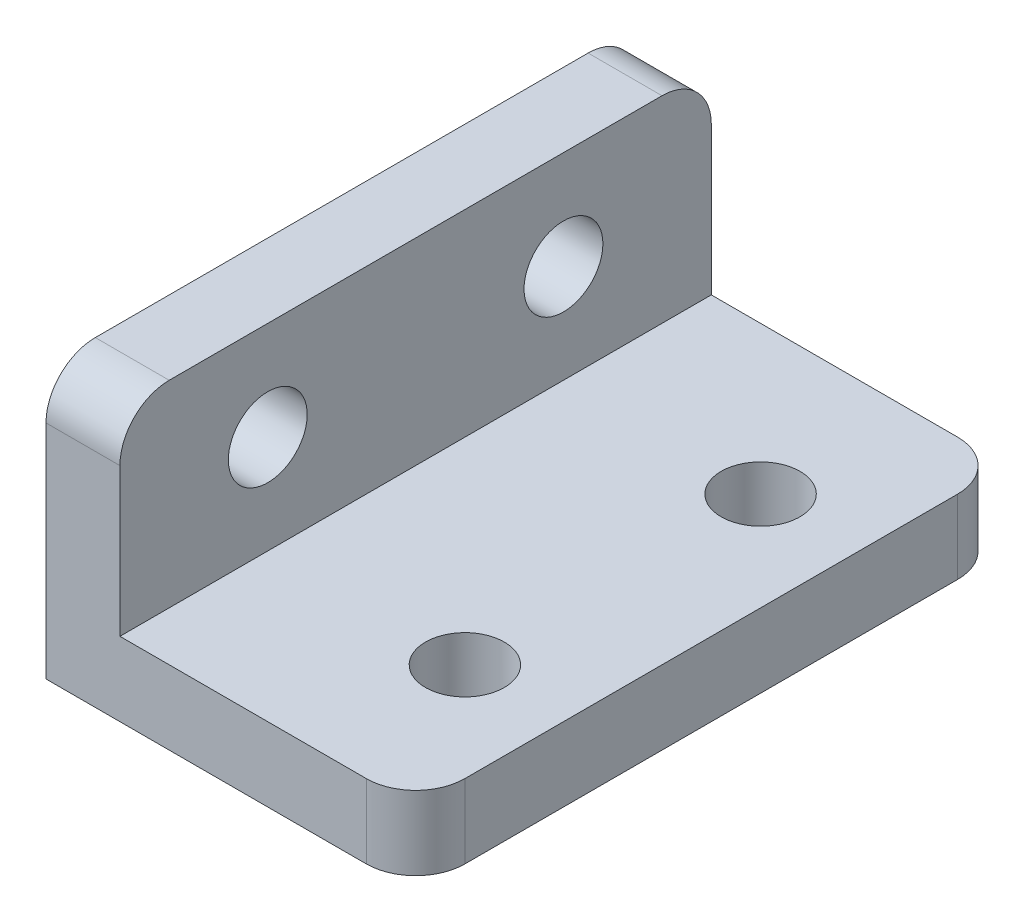
from build123d import *

# Parameters (mm, degrees)
EXTRUDE_1_DEPTH     = 24
SKETCH_2_R          = 1.6
CUT_EXTRUDE_1_DEPTH = 24
SKETCH_3_R          = 1.6
CUT_EXTRUDE_2_DEPTH = 24
FILLET_1_R          = 2


with BuildPart() as part:
    # 草图1 → 凸台-拉伸1 (new body)
    with BuildSketch(Plane.XY):
        Polygon((6, 112.691622655), (3, 112.691622655), (3, 101.691622655), (18, 101.691622655), (18, 104.691622655), (6, 104.691622655), align=None)
    extrude(amount=-EXTRUDE_1_DEPTH)

    # 草图2 → 切除-拉伸1 (cut)
    with BuildSketch(Plane(origin=(6, 0, 0), x_dir=(0, 0, -1), z_dir=(1, 0, 0))):
        with Locations(Location((6, 108.691622655, 0), (0, 0, 90))):
            Circle(SKETCH_2_R)
        with Locations(Location((18, 108.691622655, 0), (0, 0, 90))):
            Circle(SKETCH_2_R)
    extrude(amount=-CUT_EXTRUDE_1_DEPTH, mode=Mode.SUBTRACT)

    # 草图3 → 切除-拉伸2 (cut)
    with BuildSketch(Plane(origin=(0, 104.691622655, 0), x_dir=(1, 0, 0), z_dir=(0, 1, 0))):
        with Locations(Location((14, 6, 0), (0, 0, 180))):
            Circle(SKETCH_3_R)
        with Locations(Location((14, 18, 0), (0, 0, 180))):
            Circle(SKETCH_3_R)
    extrude(amount=-CUT_EXTRUDE_2_DEPTH, mode=Mode.SUBTRACT)

    # 圆角1
    fillet_1_edges = [part.edges().sort_by_distance(p)[0] for p in [
        (4.5, 112.691622655, -24),
        (4.5, 112.691622655, 0),
        (18, 103.191622655, -24),
        (18, 103.191622655, 0),
    ]]
    fillet(fillet_1_edges, radius=FILLET_1_R)


solid = part.part
